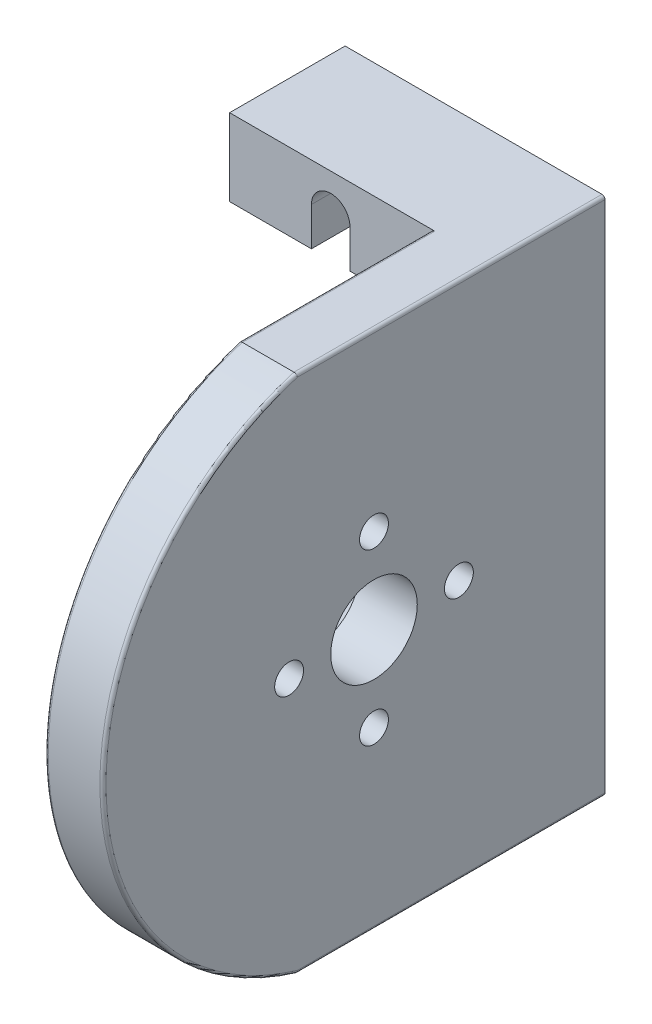
from build123d import *

# Parameters (mm, degrees)
BOSS_EXTRUDE1_DEPTH = 25.4
CUT_EXTRUDE1_REACH  = 56.237
SKETCH3_R           = 3.5687
CUT_EXTRUDE2_REACH  = 56.237
SKETCH5_W           = 16.66875
SKETCH5_H           = 42.8625
CUT_EXTRUDE3_DEPTH  = 15.875
BOSS_EXTRUDE2_DEPTH = 4.7625
CUT_EXTRUDE5_REACH  = 65.33
SKETCH9_R           = 1.190625
FILLET1_R           = 0.254
FILLET2_R           = 1.5875


with BuildPart() as part:
    # Sketch2 → Boss-Extrude1 (new body)
    with BuildSketch(Plane.XY):
        Polygon((0, 0), (0, 6.35), (16.66875, 6.35), (16.66875, 36.5125), (0, 36.5125), (0, 42.8625), (21.43125, 42.8625), (21.43125, 0), align=None)
    extrude(amount=BOSS_EXTRUDE1_DEPTH)

    # Sketch3 → Cut-Extrude1 (cut, up to next)
    with BuildSketch(Plane(origin=(21.43125, 0, 0), x_dir=(0, 0, -1), z_dir=(1, 0, 0)), mode=Mode.PRIVATE) as cut_extrude1_sk1:
        with Locations((-19.05, 21.43125)):
            Circle(SKETCH3_R)
    cut_extrude1_tool1 = extrude(cut_extrude1_sk1.sketch, amount=-CUT_EXTRUDE1_REACH, mode=Mode.PRIVATE) & part.part
    add(cut_extrude1_tool1.solids().sort_by_distance((21.43125, 21.43125, 19.05))[0], mode=Mode.SUBTRACT)

    # Sketch4 → Cut-Extrude2 (cut, up to next)
    with BuildSketch(Plane.XY.offset(25.4), mode=Mode.PRIVATE) as cut_extrude2_sk1:
        with BuildLine():
            Line((9.921875, 3.18125), (9.921875, 6.35))
            Line((9.921875, 6.35), (6.746875, 6.35))
            Line((6.746875, 6.35), (6.746875, 3.18125))
            ThreePointArc((6.746875, 3.18125), (8.334375, 1.59375), (9.921875, 3.18125))
        make_face()
    cut_extrude2_tool1 = extrude(cut_extrude2_sk1.sketch, amount=-CUT_EXTRUDE2_REACH, mode=Mode.PRIVATE) & part.part
    # Sketch4 → Cut-Extrude2 (cut, up to next)
    with BuildSketch(Plane.XY.offset(25.4), mode=Mode.PRIVATE) as cut_extrude2_sk2:
        with BuildLine():
            Line((6.746875, 36.5125), (9.921875, 36.5125))
            Line((9.921875, 36.5125), (9.921875, 39.68125))
            ThreePointArc((9.921875, 39.68125), (8.334375, 41.26875), (6.746875, 39.68125))
            Line((6.746875, 39.68125), (6.746875, 36.5125))
        make_face()
    cut_extrude2_tool2 = extrude(cut_extrude2_sk2.sketch, amount=-CUT_EXTRUDE2_REACH, mode=Mode.PRIVATE) & part.part
    add(cut_extrude2_tool1.solids().sort_by_distance((8.334375, 4.127999, 25.4))[0], mode=Mode.SUBTRACT)
    add(cut_extrude2_tool2.solids().sort_by_distance((8.334375, 38.734501, 25.4))[0], mode=Mode.SUBTRACT)

    # Sketch5 → Cut-Extrude3 (cut)
    with BuildSketch(Plane.XY.offset(25.4)):
        with Locations((8.334375, 21.43125)):
            Rectangle(SKETCH5_W, SKETCH5_H)
    extrude(amount=-CUT_EXTRUDE3_DEPTH, mode=Mode.SUBTRACT)

    # Sketch6 → Boss-Extrude2 (add)
    with BuildSketch(Plane(origin=(21.43125, 0, 0), x_dir=(0, 0, -1), z_dir=(1, 0, 0))):
        with BuildLine():
            ThreePointArc((-25.4, 42.8625), (-41.402202947, 21.43125), (-25.4, 0))
            Line((-25.4, 0), (-25.4, 42.8625))
        make_face()
    extrude(amount=-BOSS_EXTRUDE2_DEPTH)

    # Sketch9 → Cut-Extrude5 (cut, up to next)
    with BuildSketch(Plane(origin=(21.43125, 0, 0), x_dir=(0, 0, -1), z_dir=(1, 0, 0)), mode=Mode.PRIVATE) as cut_extrude5_sk1:
        with Locations((-12.05, 21.43125)):
            Circle(SKETCH9_R)
    cut_extrude5_tool1 = extrude(cut_extrude5_sk1.sketch, amount=-CUT_EXTRUDE5_REACH, mode=Mode.PRIVATE) & part.part
    # Sketch9 → Cut-Extrude5 (cut, up to next)
    with BuildSketch(Plane(origin=(21.43125, 0, 0), x_dir=(0, 0, -1), z_dir=(1, 0, 0)), mode=Mode.PRIVATE) as cut_extrude5_sk2:
        with Locations((-19.05, 14.43125)):
            Circle(SKETCH9_R)
    cut_extrude5_tool2 = extrude(cut_extrude5_sk2.sketch, amount=-CUT_EXTRUDE5_REACH, mode=Mode.PRIVATE) & part.part
    # Sketch9 → Cut-Extrude5 (cut, up to next)
    with BuildSketch(Plane(origin=(21.43125, 0, 0), x_dir=(0, 0, -1), z_dir=(1, 0, 0)), mode=Mode.PRIVATE) as cut_extrude5_sk3:
        with Locations((-26.05, 21.43125)):
            Circle(SKETCH9_R)
    cut_extrude5_tool3 = extrude(cut_extrude5_sk3.sketch, amount=-CUT_EXTRUDE5_REACH, mode=Mode.PRIVATE) & part.part
    # Sketch9 → Cut-Extrude5 (cut, up to next)
    with BuildSketch(Plane(origin=(21.43125, 0, 0), x_dir=(0, 0, -1), z_dir=(1, 0, 0)), mode=Mode.PRIVATE) as cut_extrude5_sk4:
        with Locations((-19.05, 28.43125)):
            Circle(SKETCH9_R)
    cut_extrude5_tool4 = extrude(cut_extrude5_sk4.sketch, amount=-CUT_EXTRUDE5_REACH, mode=Mode.PRIVATE) & part.part
    add(cut_extrude5_tool1.solids().sort_by_distance((21.43125, 21.43125, 12.05))[0], mode=Mode.SUBTRACT)
    add(cut_extrude5_tool2.solids().sort_by_distance((21.43125, 14.43125, 19.05))[0], mode=Mode.SUBTRACT)
    add(cut_extrude5_tool3.solids().sort_by_distance((21.43125, 21.43125, 26.05))[0], mode=Mode.SUBTRACT)
    add(cut_extrude5_tool4.solids().sort_by_distance((21.43125, 28.43125, 19.05))[0], mode=Mode.SUBTRACT)

    # Fillet1
    fillet1_edges = [part.edges().sort_by_distance(p)[0] for p in [
        (21.43125, 21.43125, 41.402202947),
        (16.66875, 21.43125, 41.402202947),
        (21.43125, 42.8625, 12.7),
        (21.43125, 0, 12.7),
        (16.66875, 42.8625, 17.4625),
        (16.66875, 0, 17.4625),
    ]]
    fillet(fillet1_edges, radius=FILLET1_R)

    # Fillet2
    fillet2_edges = [part.edges().sort_by_distance(p)[0] for p in [
        (16.66875, 6.35, 4.7625),
        (16.66875, 36.5125, 4.7625),
    ]]
    fillet(fillet2_edges, radius=FILLET2_R)


solid = part.part
